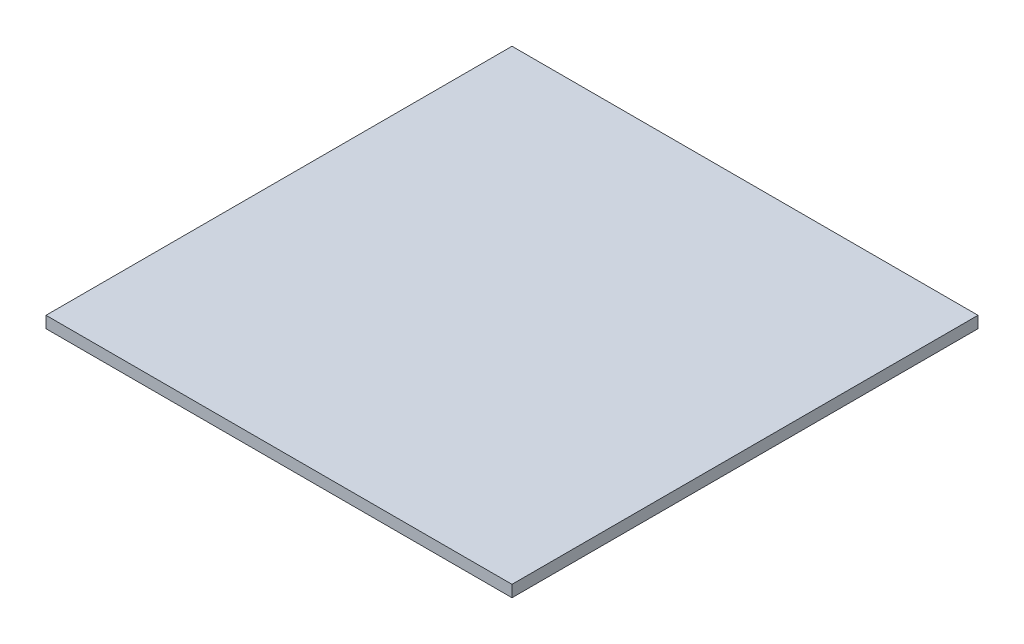
from build123d import *

# Parameters (mm, degrees)
SKETCH1_W           = 8000
SKETCH1_H           = 8000
BOSS_EXTRUDE1_DEPTH = 200


with BuildPart() as part:
    # Sketch1 → Boss-Extrude1 (new body)
    with BuildSketch(Plane(origin=(0, 0, 0), x_dir=(1, 0, 0), z_dir=(0, 1, 0))):
        Rectangle(SKETCH1_W, SKETCH1_H)
    extrude(amount=BOSS_EXTRUDE1_DEPTH)


solid = part.part
